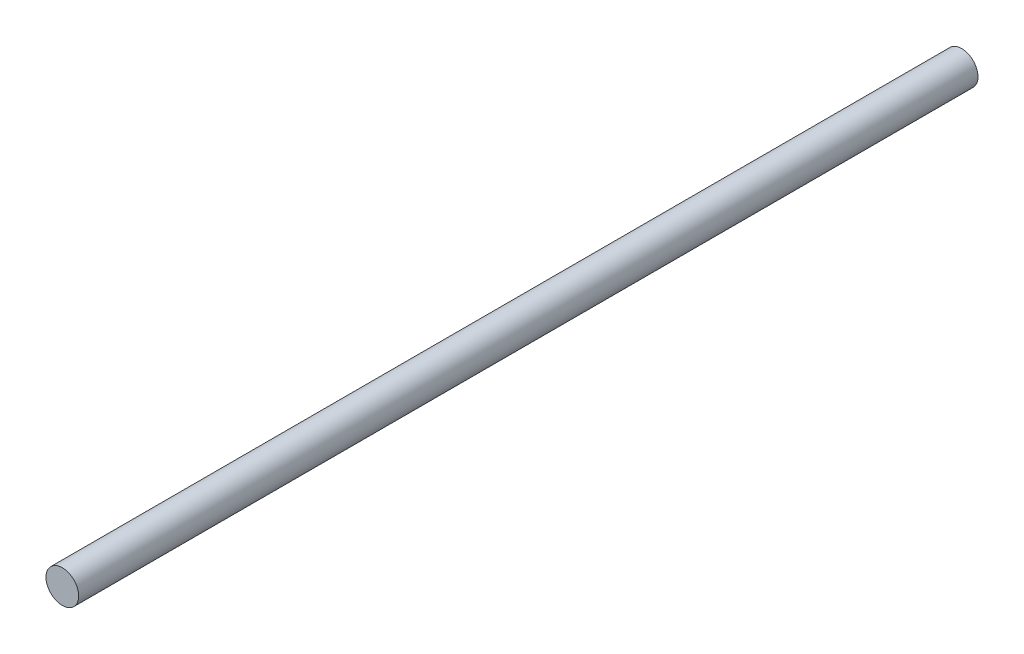
from build123d import *

# Parameters (mm, degrees)
SKETCH1_R           = 4
BOSS_EXTRUDE1_DEPTH = 220


with BuildPart() as part:
    # Sketch1 → Boss-Extrude1 (new body)
    with BuildSketch(Plane.XY):
        with Locations((-5.987136889, 4.964489284)):
            Circle(SKETCH1_R)
    extrude(amount=BOSS_EXTRUDE1_DEPTH)


solid = part.part
